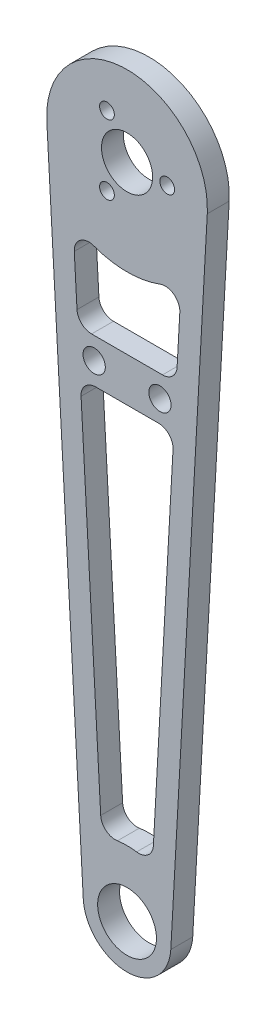
from build123d import *

# Parameters (mm, degrees)
SKETCH_1_R      = 11
SKETCH_1_R_2    = 3.5
SKETCH_1_R_3    = 1.01
SKETCH_1_R_4    = 6
SKETCH_1_R_5    = 4.025
EXTRUDE_1_DEPTH = 3
SKETCH_2_R      = 1.525
EXTRUDE_2_DEPTH = 3
FILLET_1_R      = 2


with BuildPart() as part:
    # 草图1 → 凸台-拉伸1 (new body)
    # profile 1 of 3: a face of its own
    with BuildSketch(Plane.XY):
        with BuildLine():
            ThreePointArc((10.983011573, -0.611111111), (0, -11), (-10.983011573, -0.611111111))
            Line((-10.983011573, -0.611111111), (-5.990733585, -90.333333333))
            ThreePointArc((-5.990733585, -90.333333333), (-0.166731054, -84.002317051), (6, -90))
            ThreePointArc((6, -90), (5.997682949, -90.166731054), (5.990733585, -90.333333333))
            Line((5.990733585, -90.333333333), (10.983011573, -0.611111111))
        make_face()
        with BuildLine():
            Line((-3.466771313, -81.694489982), (-7.418369738, -10.675569794))
            ThreePointArc((-7.418369738, -10.675569794), (0, -13), (7.418369738, -10.675569794))
            Line((7.418369738, -10.675569794), (3.466771313, -81.694489982))
            ThreePointArc((3.466771313, -81.694489982), (0, -81), (-3.466771313, -81.694489982))
        make_face(mode=Mode.SUBTRACT)
    # profile 2 of 3: a face of its own
    with BuildSketch(Plane.XY):
        Circle(SKETCH_1_R)
        Circle(SKETCH_1_R_2, mode=Mode.SUBTRACT)
        with Locations((-2.75, 4.763139721)):
            Circle(SKETCH_1_R_3, mode=Mode.SUBTRACT)
        with Locations((-2.75, -4.763139721)):
            Circle(SKETCH_1_R_3, mode=Mode.SUBTRACT)
        with Locations((5.5, 0)):
            Circle(SKETCH_1_R_3, mode=Mode.SUBTRACT)
    # profile 3 of 3: a face of its own
    with BuildSketch(Plane.XY):
        with Locations((0, -90)):
            Circle(SKETCH_1_R_4)
        with Locations((0, -90)):
            Circle(SKETCH_1_R_5, mode=Mode.SUBTRACT)
    extrude(amount=EXTRUDE_1_DEPTH)

    # 草图2 → 凸台-拉伸2 (add)
    with BuildSketch(Plane.XY.offset(3)):
        Polygon((-6.745155967, -22.774702841), (6.745155967, -22.774702841), (6.411307036, -28.774702841), (-6.411307036, -28.774702841), align=None)
        with Locations((-4.5, -25.774702841)):
            Circle(SKETCH_2_R, mode=Mode.SUBTRACT)
        with Locations((4.5, -25.774702841)):
            Circle(SKETCH_2_R, mode=Mode.SUBTRACT)
    extrude(amount=-EXTRUDE_2_DEPTH)

    # 圆角1
    fillet_1_edges = [part.edges().sort_by_distance(p)[0] for p in [
        (7.418369738, -10.675569794, 1.5),
        (-7.418369738, -10.675569794, 1.5),
        (-3.466771313, -81.694489982, 1.5),
        (3.466771313, -81.694489982, 1.5),
        (6.411307036, -28.774702841, 1.5),
        (6.745155967, -22.774702841, 1.5),
        (-6.745155967, -22.774702841, 1.5),
        (-6.411307036, -28.774702841, 1.5),
    ]]
    fillet(fillet_1_edges, radius=FILLET_1_R)


solid = part.part
